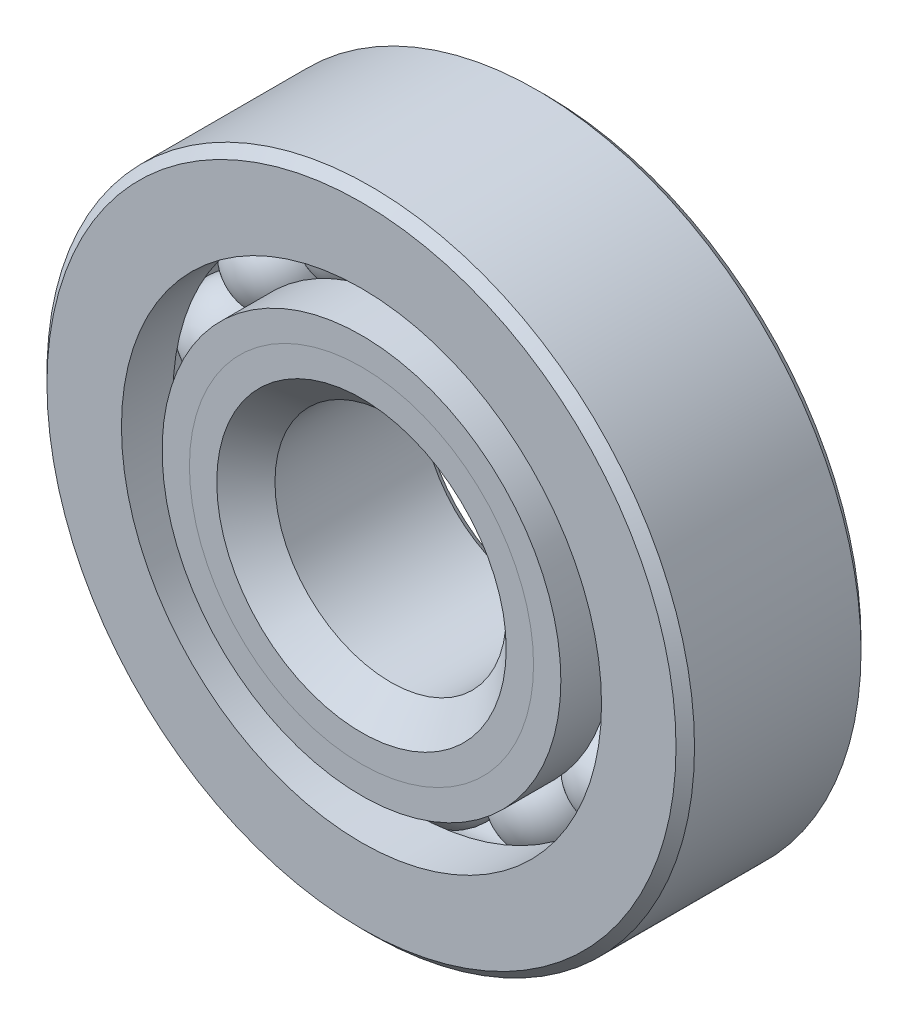
from build123d import *

# Parameters (mm, degrees)
CIRPATTERN1_COUNT = 14


with BuildPart() as part:
    # Sketch1 → Revolve1 (revolve)
    with BuildSketch(Plane(origin=(0, 0, 0), x_dir=(0, 0, -1), z_dir=(1, 0, 0))):
        with BuildLine():
            Line((2.8575, 11.1125), (-2.8575, 11.1125))
            Line((-2.8575, 11.1125), (-3.175, 10.795))
            Line((-3.175, 10.795), (-3.175, 8.238427198))
            Line((-3.175, 8.238427198), (-1.411111111, 8.238427198))
            ThreePointArc((-1.411111111, 8.238427198), (0, 9.114843052), (1.411111111, 8.238427198))
            Line((1.411111111, 8.238427198), (3.175, 8.238427198))
            Line((3.175, 8.238427198), (3.175, 10.795))
            Line((3.175, 10.795), (2.8575, 11.1125))
        make_face()
    revolve(axis=Axis((0, 0, 3.175), (0, 0, -1)))


with BuildPart() as body_2:
    # Sketch2 → Revolve2 (revolve)
    with BuildSketch(Plane(origin=(0, 0, 0), x_dir=(0, 0, -1), z_dir=(1, 0, 0))):
        with BuildLine():
            Line((-3.175, 6.842822802), (-1.411111111, 6.842822802))
            ThreePointArc((-1.411111111, 6.842822802), (-0.830562959, 6.203341318), (0, 5.966406948))
            Line((0, 5.966406948), (0, 4.967578474))
            Line((0, 4.967578474), (-2.237377836, 4.967578474))
            Line((-2.237377836, 4.967578474), (-3.175, 5.905200638))
            Line((-3.175, 5.905200638), (-3.175, 6.842822802))
        make_face()
    revolve(axis=Axis((0, 0, 3.175), (0, 0, -1)))


with BuildPart() as body_3:
    # Sketch3 → Revolve3 (revolve)
    with BuildSketch(Plane(origin=(0, 0, 0), x_dir=(0, 0, -1), z_dir=(1, 0, 0))):
        with BuildLine():
            Line((-3.175, 5.905200638), (-2.237377836, 4.967578474))
            Line((-2.237377836, 4.967578474), (0, 4.967578474))
            Line((0, 4.967578474), (0, 5.966406948))
            ThreePointArc((0, 5.966406948), (0.830562959, 6.203341318), (1.411111111, 6.842822802))
            Line((1.411111111, 6.842822802), (3.175, 6.842822802))
            Line((3.175, 6.842822802), (3.175, 4.28625))
            Line((3.175, 4.28625), (2.8575, 3.96875))
            Line((2.8575, 3.96875), (-2.176171526, 3.96875))
            Line((-2.176171526, 3.96875), (-3.175, 4.967578474))
            Line((-3.175, 4.967578474), (-3.175, 5.905200638))
        make_face()
    revolve(axis=Axis((0, 0, 3.175), (0, 0, -1)))


with BuildPart() as body_4:
    # Sketch4 → Revolve4 (revolve)
    with BuildSketch(Plane(origin=(0, 0, 0), x_dir=(0, 0, -1), z_dir=(1, 0, 0))):
        with BuildLine():
            Line((-1.574218052, 7.540625), (1.574218052, 7.540625))
            ThreePointArc((1.574218052, 7.540625), (0, 9.114843052), (-1.574218052, 7.540625))
        make_face()
    revolve(axis=Axis((0, 7.540625, 1.574218052), (0, 0, -1)))


with BuildPart() as cirpattern1_1:
    # CirPattern1: pattern copy
    add(body_4.part.rotate(Axis((0, 0, -3.175), (0, 0, 1)), 1 * 360 / CIRPATTERN1_COUNT))


with BuildPart() as cirpattern1_2:
    # CirPattern1: pattern copy
    add(body_4.part.rotate(Axis((0, 0, -3.175), (0, 0, 1)), 2 * 360 / CIRPATTERN1_COUNT))


with BuildPart() as cirpattern1_3:
    # CirPattern1: pattern copy
    add(body_4.part.rotate(Axis((0, 0, -3.175), (0, 0, 1)), 3 * 360 / CIRPATTERN1_COUNT))


with BuildPart() as cirpattern1_4:
    # CirPattern1: pattern copy
    add(body_4.part.rotate(Axis((0, 0, -3.175), (0, 0, 1)), 4 * 360 / CIRPATTERN1_COUNT))


with BuildPart() as cirpattern1_5:
    # CirPattern1: pattern copy
    add(body_4.part.rotate(Axis((0, 0, -3.175), (0, 0, 1)), 5 * 360 / CIRPATTERN1_COUNT))


with BuildPart() as cirpattern1_6:
    # CirPattern1: pattern copy
    add(body_4.part.rotate(Axis((0, 0, -3.175), (0, 0, 1)), 6 * 360 / CIRPATTERN1_COUNT))


with BuildPart() as cirpattern1_7:
    # CirPattern1: pattern copy
    add(body_4.part.rotate(Axis((0, 0, -3.175), (0, 0, 1)), 7 * 360 / CIRPATTERN1_COUNT))


with BuildPart() as cirpattern1_8:
    # CirPattern1: pattern copy
    add(body_4.part.rotate(Axis((0, 0, -3.175), (0, 0, 1)), 8 * 360 / CIRPATTERN1_COUNT))


with BuildPart() as cirpattern1_9:
    # CirPattern1: pattern copy
    add(body_4.part.rotate(Axis((0, 0, -3.175), (0, 0, 1)), 9 * 360 / CIRPATTERN1_COUNT))


with BuildPart() as cirpattern1_10:
    # CirPattern1: pattern copy
    add(body_4.part.rotate(Axis((0, 0, -3.175), (0, 0, 1)), 10 * 360 / CIRPATTERN1_COUNT))


with BuildPart() as cirpattern1_11:
    # CirPattern1: pattern copy
    add(body_4.part.rotate(Axis((0, 0, -3.175), (0, 0, 1)), 11 * 360 / CIRPATTERN1_COUNT))


with BuildPart() as cirpattern1_12:
    # CirPattern1: pattern copy
    add(body_4.part.rotate(Axis((0, 0, -3.175), (0, 0, 1)), 12 * 360 / CIRPATTERN1_COUNT))


with BuildPart() as cirpattern1_13:
    # CirPattern1: pattern copy
    add(body_4.part.rotate(Axis((0, 0, -3.175), (0, 0, 1)), 13 * 360 / CIRPATTERN1_COUNT))


solid = Compound([part.part, body_2.part, body_3.part, body_4.part, cirpattern1_1.part, cirpattern1_2.part, cirpattern1_3.part, cirpattern1_4.part, cirpattern1_5.part, cirpattern1_6.part, cirpattern1_7.part, cirpattern1_8.part, cirpattern1_9.part, cirpattern1_10.part, cirpattern1_11.part, cirpattern1_12.part, cirpattern1_13.part])
